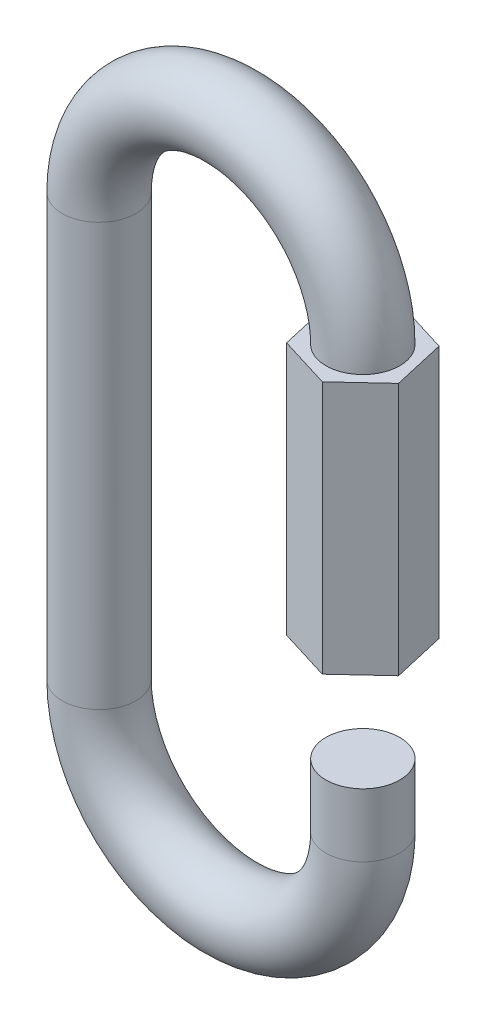
from build123d import *

# Parameters (mm, degrees)
SKETCH1_R           = 3.5
BOSS_EXTRUDE1_DEPTH = 24


with BuildPart() as part:
    # Sweep1: sweep along a path in Sketch2
    with BuildLine(Plane.XY) as sweep1_path:
        Line((0, 0), (0, 24))
        ThreePointArc((0, 24), (-12.5, 36.5), (-25, 24))
        Line((-25, 24), (-25, -16.000012487))
        ThreePointArc((-25, -16.000012487), (-12.499993756, -28.5), (0, -15.999999999))
        Line((0, -15.999999999), (0, -10))
    # Sketch1 → Sweep1 (sweep)
    with BuildSketch(Plane(origin=(0, 0, 0), x_dir=(1, 0, 0), z_dir=(0, 1, 0))):
        Circle(SKETCH1_R)
    sweep(path=sweep1_path.line)

    # Sketch3 → Boss-Extrude1 (add)
    with BuildSketch(Plane.XZ):
        Polygon((4.887708702, 1.504241274), (1.141143194, 4.985000539), (-3.746565508, 3.480759265), (-4.887708702, -1.504241274), (-1.141143194, -4.985000539), (3.746565508, -3.480759265), align=None)
    extrude(amount=-BOSS_EXTRUDE1_DEPTH)


solid = part.part
